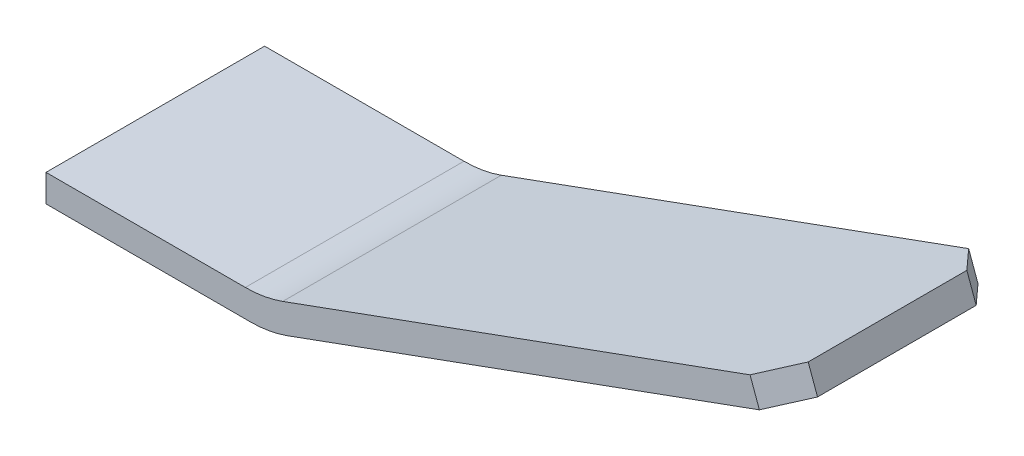
from build123d import *

# Parameters (mm, degrees)
BOSS_EXTRUDE1_DEPTH = 25.4
FILLET1_R           = 12.7
CUT_EXTRUDE1_DEPTH  = 94.010697189


with BuildPart() as part:
    # Sketch2 → Boss-Extrude1 (new body)
    with BuildSketch(Plane.XY):
        Polygon((0, 0), (0, 3.175), (25.4, 3.175), (85.07048142, 24.893279101), (86.156395375, 21.90975503), (25.959838164, 0), align=None)
    extrude(amount=BOSS_EXTRUDE1_DEPTH)

    # Fillet1
    fillet1_edges = [part.edges().sort_by_distance(p)[0] for p in [
        (25.4, 3.175, 12.7),
        (25.959838164, 0, 12.7),
    ]]
    fillet(fillet1_edges, radius=FILLET1_R)

    # Sketch3 → Cut-Extrude1 (cut, through all)
    with BuildSketch(Plane(origin=(1.950810242, -5.35980709, 0), x_dir=(0.9396926207859078, 0.3420201433256703, 0), z_dir=(-0.3420201433256703, 0.9396926207859079, 0))):
        Polygon((88.454106523, 0), (84.971991459, 0), (88.454106523, -3.482115064), align=None)
        Polygon((88.454106523, -25.4), (88.454106523, -21.917884936), (84.971991459, -25.4), align=None)
    extrude(amount=-CUT_EXTRUDE1_DEPTH, mode=Mode.SUBTRACT)


solid = part.part
